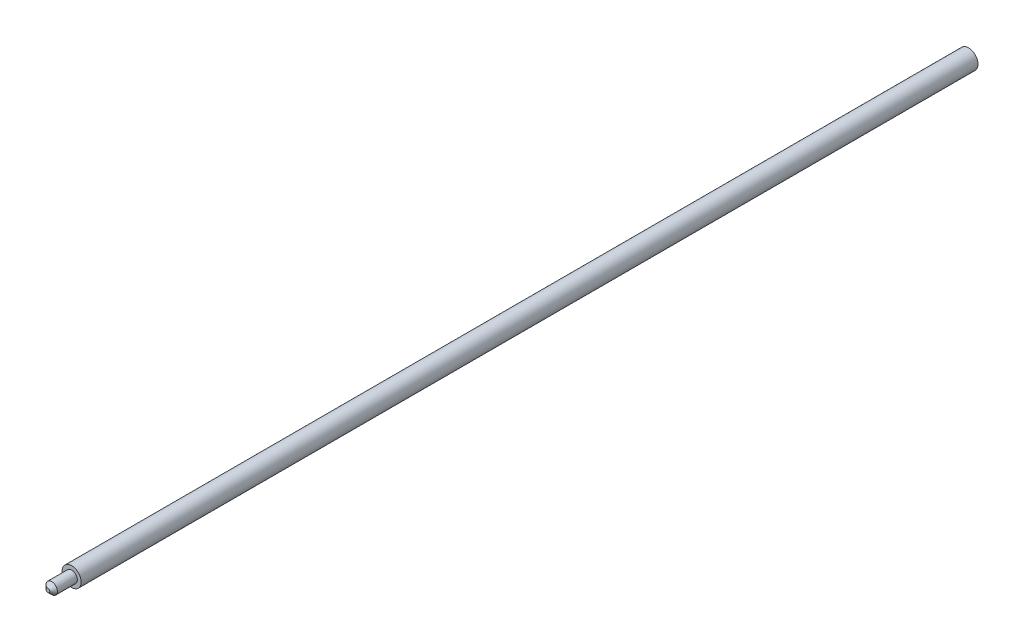
from build123d import *

# Parameters (mm, degrees)
SKETCH1_R           = 1.27
BOSS_EXTRUDE1_DEPTH = 119.9642
SKETCH3_R           = 0.762
BOSS_EXTRUDE2_DEPTH = 3.175
CHAMFER1_SIZE       = 0.508


with BuildPart() as part:
    # Sketch1 → Boss-Extrude1 (new body)
    with BuildSketch(Plane.XY):
        Circle(SKETCH1_R)
    extrude(amount=BOSS_EXTRUDE1_DEPTH)

    # Sketch3 → Boss-Extrude2 (add)
    with BuildSketch(Plane.XY.offset(119.9642)):
        Circle(SKETCH3_R)
    extrude(amount=BOSS_EXTRUDE2_DEPTH)

    # Chamfer1
    chamfer1_edges = [part.edges().sort_by_distance(p)[0] for p in [
        (-0.762, 0, 123.1392),
    ]]
    chamfer(chamfer1_edges, length=CHAMFER1_SIZE)


solid = part.part
